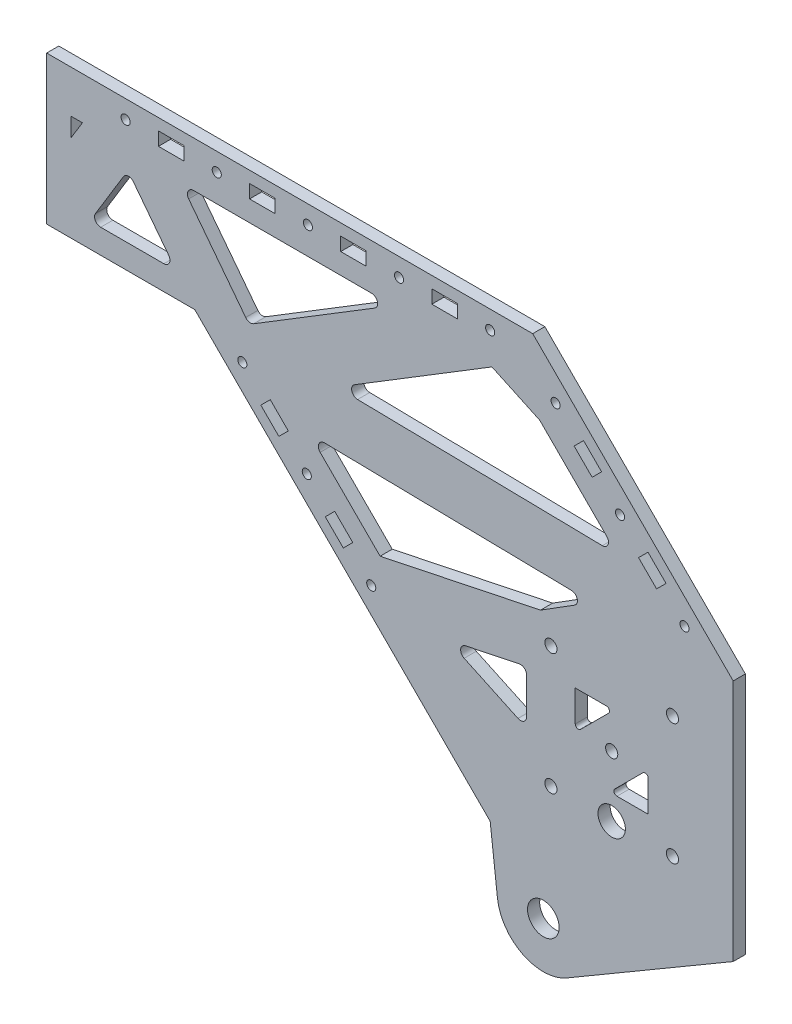
from build123d import *

# Parameters (mm, degrees)
SKETCH_1_R          = 1.5
SKETCH_1_R_2        = 4.5
SKETCH_1_R_3        = 2
SKETCH_1_R_4        = 5.2
SKETCH_1_W          = 8.4
SKETCH_1_H          = 4.4
EXTRUDE_1_DEPTH     = 4
CUT_EXTRUDE_1_DEPTH = 10


with BuildPart() as part:
    # 草图1 → 凸台-拉伸1 (new body)
    with BuildSketch(Plane.XY):
        with BuildLine():
            Line((-138.972571837, 141.054738201), (21.027428163, 141.054738201))
            Line((21.027428163, 141.054738201), (87.027428163, 75.054738201))
            Line((87.027428163, 75.054738201), (87.027428163, -4.945261799))
            Line((87.027428163, -4.945261799), (32.205877569, -37.034385558))
            ThreePointArc((32.205877569, -37.034385558), (17.739495323, -37.516550842), (9.428458368, -25.666008097))
            Line((9.428458368, -25.666008097), (7.027428163, -4.945261799))
            Line((7.027428163, -4.945261799), (-90.203942848, 92.286109212))
            Line((-90.203942848, 92.286109212), (-138.972571837, 92.286109212))
            Line((-138.972571837, 92.286109212), (-138.972571837, 141.054738201))
        make_face()
        with Locations((-52.972571837, 135.054738201)):
            Circle(SKETCH_1_R, mode=Mode.SUBTRACT)
        with Locations((47.027428163, 15.054738201)):
            Circle(SKETCH_1_R_2, mode=Mode.SUBTRACT)
        with Locations(Location((-22.972571837, 135.054738201, 0), (0, 0, 180))):
            Circle(SKETCH_1_R, mode=Mode.SUBTRACT)
        with Locations((7.027428163, 135.054738201)):
            Circle(SKETCH_1_R, mode=Mode.SUBTRACT)
        with Locations((67.027428163, 15.054738201)):
            Circle(SKETCH_1_R_3, mode=Mode.SUBTRACT)
        with Locations((67.027428163, 55.054738201)):
            Circle(SKETCH_1_R_3, mode=Mode.SUBTRACT)
        with Locations((27.027428163, 55.054738201)):
            Circle(SKETCH_1_R_3, mode=Mode.SUBTRACT)
        with Locations((27.027428163, 15.054738201)):
            Circle(SKETCH_1_R_3, mode=Mode.SUBTRACT)
        with Locations((47.027428163, 35.054738201)):
            Circle(SKETCH_1_R_3, mode=Mode.SUBTRACT)
        with Locations(Location((-112.972571837, 135.054738201, 0), (0, 0, 180))):
            Circle(SKETCH_1_R, mode=Mode.SUBTRACT)
        with Locations((-82.972571837, 135.054738201)):
            Circle(SKETCH_1_R, mode=Mode.SUBTRACT)
        with Locations((24.527428163, -23.916404969)):
            Circle(SKETCH_1_R_4, mode=Mode.SUBTRACT)
        with Locations((49.784787476, 103.812097514)):
            Circle(SKETCH_1_R, mode=Mode.SUBTRACT)
        with Locations(Location((70.997990912, 82.598894078, 0), (0, 0, 180))):
            Circle(SKETCH_1_R, mode=Mode.SUBTRACT)
        with Locations(Location((28.571584041, 125.025300949, 0), (0, 0, 180))):
            Circle(SKETCH_1_R, mode=Mode.SUBTRACT)
        with Locations((-53.337194475, 63.904642213)):
            Circle(SKETCH_1_R, mode=Mode.SUBTRACT)
        with Locations(Location((-32.123991039, 42.691438778, 0), (0, 0, 180))):
            Circle(SKETCH_1_R, mode=Mode.SUBTRACT)
        with Locations(Location((-74.55039791, 85.117845649, 0), (0, 0, 180))):
            Circle(SKETCH_1_R, mode=Mode.SUBTRACT)
        with Locations((-37.972571837, 135.054738201)):
            Rectangle(SKETCH_1_W, SKETCH_1_H, mode=Mode.SUBTRACT)
        with Locations((-7.972571837, 135.054738201)):
            Rectangle(SKETCH_1_W, SKETCH_1_H, mode=Mode.SUBTRACT)
        with Locations((-97.972571837, 135.054738201)):
            Rectangle(SKETCH_1_W, SKETCH_1_H, mode=Mode.SUBTRACT)
        with Locations((-67.972571837, 135.054738201)):
            Rectangle(SKETCH_1_W, SKETCH_1_H, mode=Mode.SUBTRACT)
        Polygon((55.865905794, 94.619709358), (61.805602756, 88.680012396), (64.916872594, 91.791282234), (58.977175632, 97.730979196), align=None, mode=Mode.SUBTRACT)
        Polygon((34.652702359, 115.832912794), (37.763972196, 118.944182631), (43.703669158, 113.004485669), (40.592399321, 109.893215832), align=None, mode=Mode.SUBTRACT)
        Polygon((-47.256076157, 54.712254058), (-41.316379195, 48.772557096), (-38.205109357, 51.883826933), (-44.144806319, 57.823523895), align=None, mode=Mode.SUBTRACT)
        Polygon((-68.469279592, 75.925457494), (-65.358009755, 79.036727331), (-59.418312793, 73.097030369), (-62.52958263, 69.985760532), align=None, mode=Mode.SUBTRACT)
    extrude(amount=EXTRUDE_1_DEPTH)

    # 草图2 → 切除-拉伸1 (cut)
    with BuildSketch(Plane(origin=(0, 0, 0), x_dir=(-1, 0, 0), z_dir=(0, 0, -1))):
        with BuildLine():
            Line((98.792246858, 103.505713788), (110.418981679, 118.616857906))
            ThreePointArc((110.418981679, 118.616857906), (112.113620797, 119.394251765), (113.713072721, 118.436182616))
            Line((113.713072721, 118.436182616), (122.899473042, 103.325038498))
            ThreePointArc((122.899473042, 103.325038498), (122.933741653, 101.305767071), (121.190489151, 100.286109212))
            Line((121.190489151, 100.286109212), (100.377354008, 100.286109212))
            ThreePointArc((100.377354008, 100.286109212), (98.583028348, 101.402709289), (98.792246858, 103.505713788))
        make_face()
        with BuildLine():
            Line((1.540878081, 37.232518875), (-16.180834634, 28.952587901))
            ThreePointArc((-16.180834634, 28.952587901), (-18.101395793, 29.077384984), (-19.027428163, 30.764570074))
            Line((-19.027428163, 30.764570074), (-19.027428163, 42.748534587))
            ThreePointArc((-19.027428163, 42.748534587), (-18.288705306, 44.30068792), (-16.618248194, 44.706230108))
            Line((-16.618248194, 44.706230108), (1.103464521, 41.002196569))
            ThreePointArc((1.103464521, 41.002196569), (2.680954944, 39.275023825), (1.540878081, 37.232518875))
        make_face()
        Polygon((127.198237985, 127.054738201), (130.972571837, 120.84615804), (130.972571837, 127.054738201), align=None)
        with BuildLine():
            Line((73.446278945, 98.44171591), (92.214930542, 122.835133626))
            ThreePointArc((92.214930542, 122.835133626), (92.424149051, 124.938138124), (90.629823391, 126.054738201))
            Line((90.629823391, 126.054738201), (32.011635988, 126.054738201))
            ThreePointArc((32.011635988, 126.054738201), (30.086594754, 124.59715524), (30.967460822, 122.348954445))
            Line((30.967460822, 122.348954445), (70.816996628, 97.955536729))
            ThreePointArc((70.816996628, 97.955536729), (72.224826028, 97.694659457), (73.446278945, 98.44171591))
        make_face()
        with BuildLine():
            Line((36.616706696, 93.462689168), (-43.937662379, 92.068564807))
            ThreePointArc((-43.937662379, 92.068564807), (-45.813338133, 93.286939697), (-45.386484011, 95.482478917))
            Line((-45.386484011, 95.482478917), (-23.33185922, 117.537103709))
            Line((-23.33185922, 117.537103709), (-7.607283327, 124.857355573))
            Line((-7.607283327, 124.857355573), (37.626273792, 97.168173472))
            ThreePointArc((37.626273792, 97.168173472), (38.51176098, 94.936649095), (36.616706696, 93.462689168))
        make_face()
        with BuildLine():
            Line((29.20140553, 52.49677533), (-23.612246698, 63.53541151))
            Line((-23.612246698, 63.53541151), (-34.805439363, 70.547080779))
            ThreePointArc((-34.805439363, 70.547080779), (-35.670630649, 72.777688158), (-33.778316178, 74.241693343))
            Line((-33.778316178, 74.241693343), (47.490069377, 75.64817492))
            ThreePointArc((47.490069377, 75.64817492), (49.365745131, 74.42980003), (48.93889101, 72.23426081))
            Line((48.93889101, 72.23426081), (29.20140553, 52.49677533))
        make_face()
        with BuildLine():
            Line((-59.027428163, 23.054738201), (-48.755350225, 23.054738201))
            ThreePointArc((-48.755350225, 23.054738201), (-47.831470692, 23.672054769), (-48.048243444, 24.761844982))
            Line((-48.048243444, 24.761844982), (-57.320321382, 34.033922921))
            ThreePointArc((-57.320321382, 34.033922921), (-58.410111596, 34.250695672), (-59.027428163, 33.32681614))
            Line((-59.027428163, 33.32681614), (-59.027428163, 23.054738201))
        make_face()
        with BuildLine():
            Line((-35.027428163, 36.782660262), (-35.027428163, 47.054738201))
            Line((-35.027428163, 47.054738201), (-45.299506102, 47.054738201))
            ThreePointArc((-45.299506102, 47.054738201), (-46.223385635, 46.437421633), (-46.006612883, 45.34763142))
            Line((-46.006612883, 45.34763142), (-36.734534945, 36.075553481))
            ThreePointArc((-36.734534945, 36.075553481), (-35.644744731, 35.85878073), (-35.027428163, 36.782660262))
        make_face()
    extrude(amount=-CUT_EXTRUDE_1_DEPTH, mode=Mode.SUBTRACT)


solid = part.part
